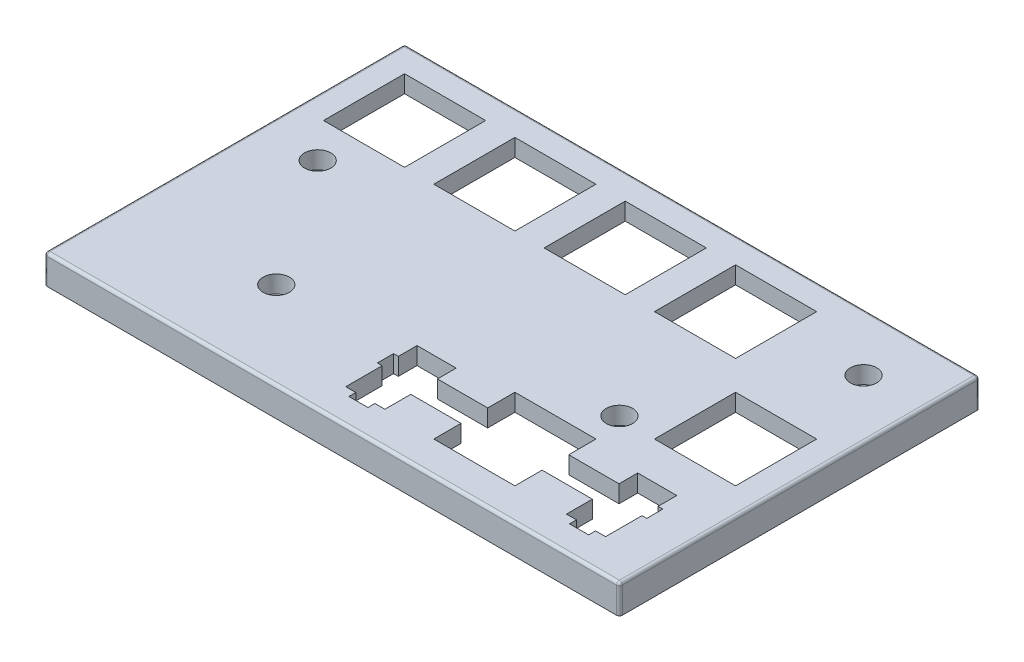
from build123d import *

# Parameters (mm, degrees)
SKETCH1_W           = 99.3
SKETCH1_H           = 62.2
SKETCH1_R           = 2.275
SKETCH1_W_2         = 14
SKETCH1_H_2         = 14
BOSS_EXTRUDE1_DEPTH = 3
SKETCH6_W           = 99.3
SKETCH6_H           = 62.2
SKETCH6_R           = 1.5
SKETCH6_W_2         = 75.15
SKETCH6_H_2         = 18
BOSS_EXTRUDE2_DEPTH = 2
FILLET1_R           = 0.5


with BuildPart() as part:
    # Sketch1 → Boss-Extrude1 (new body)
    with BuildSketch(Plane(origin=(0, 0, 0), x_dir=(1, 0, 0), z_dir=(0, 1, 0))):
        with Locations((49.65, 31.1)):
            Rectangle(SKETCH1_W, SKETCH1_H)
        with Locations(Location((10, 37.2, 0), (0, 0, 270))):
            Circle(SKETCH1_R, mode=Mode.SUBTRACT)
        with Locations(Location((89.25, 52.2, 0), (0, 0, 270))):
            Circle(SKETCH1_R, mode=Mode.SUBTRACT)
        with Locations(Location((74.25, 25.05, 0), (0, 0, 270))):
            Circle(SKETCH1_R, mode=Mode.SUBTRACT)
        with Locations(Location((25, 15.05, 0), (0, 0, 270))):
            Circle(SKETCH1_R, mode=Mode.SUBTRACT)
        with Locations((11.525, 50.675)):
            Rectangle(SKETCH1_W_2, SKETCH1_H_2, mode=Mode.SUBTRACT)
        with Locations((30.575, 50.675)):
            Rectangle(SKETCH1_W_2, SKETCH1_H_2, mode=Mode.SUBTRACT)
        with Locations((49.625, 50.675)):
            Rectangle(SKETCH1_W_2, SKETCH1_H_2, mode=Mode.SUBTRACT)
        with Locations((68.675, 50.675)):
            Rectangle(SKETCH1_W_2, SKETCH1_H_2, mode=Mode.SUBTRACT)
        with Locations((87.725, 31.625)):
            Rectangle(SKETCH1_W_2, SKETCH1_H_2, mode=Mode.SUBTRACT)
        Polygon((75.675, 14.875), (84.35, 14.875), (84.35, 18.105), (91.1, 18.105), (91.1, 14.875), (91.925, 14.875), (91.925, 12.09), (91.1, 12.09), (91.1, 5.805), (89.375, 5.805), (89.375, 4.605), (86.075, 4.605), (86.075, 5.805), (84.35, 5.805), (84.35, 10.275), (75.675, 10.275), (75.675, 5.575), (61.675, 5.575), (61.675, 10.275), (53, 10.275), (53, 5.805), (51.275, 5.805), (51.275, 4.605), (47.975, 4.605), (47.975, 5.805), (46.25, 5.805), (46.25, 12.09), (45.425, 12.09), (45.425, 14.875), (46.25, 14.875), (46.25, 18.105), (53, 18.105), (53, 14.875), (61.675, 14.875), (61.675, 19.575), (75.675, 19.575), align=None, mode=Mode.SUBTRACT)
    extrude(amount=-BOSS_EXTRUDE1_DEPTH)

    # Sketch6 → Boss-Extrude2 (add)
    with BuildSketch(Plane.XZ.offset(3)):
        with Locations((49.65, -31.1)):
            Rectangle(SKETCH6_W, SKETCH6_H)
        with Locations(Location((89.25, -52.2, 0), (0, 0, 90))):
            Circle(SKETCH6_R, mode=Mode.SUBTRACT)
        with Locations(Location((74.25, -25.05, 0), (0, 0, 90))):
            Circle(SKETCH6_R, mode=Mode.SUBTRACT)
        with Locations(Location((25, -15.05, 0), (0, 0, 90))):
            Circle(SKETCH6_R, mode=Mode.SUBTRACT)
        with Locations(Location((10, -37.2, 0), (0, 0, 90))):
            Circle(SKETCH6_R, mode=Mode.SUBTRACT)
        Polygon((78.725, -21.575), (40.1, -21.575), (40.1, -1.575), (96.725, -1.575), (96.725, -40.625), (78.725, -40.625), align=None, mode=Mode.SUBTRACT)
        with Locations((40.1, -50.675)):
            Rectangle(SKETCH6_W_2, SKETCH6_H_2, mode=Mode.SUBTRACT)
    extrude(amount=BOSS_EXTRUDE2_DEPTH)

    # Fillet1
    fillet1_edges = [part.edges().sort_by_distance(p)[0] for p in [
        (49.65, 0, -62.2),
        (99.3, 0, -31.1),
        (49.65, 0, 0),
        (0, 0, -31.1),
        (0, -2.5, -62.2),
        (99.3, -2.5, -62.2),
        (99.3, -2.5, 0),
        (0, -2.5, 0),
    ]]
    fillet(fillet1_edges, radius=FILLET1_R)


solid = part.part
